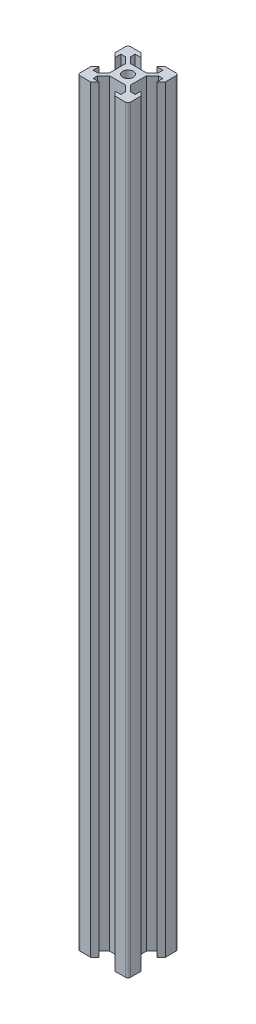
from build123d import *

# Parameters (mm, degrees)
MASTERLAYOUTSKETCH_R = 2.1
MAIN_EXTRUSION_DEPTH = 300
EDGE_FILLETS_R       = 1


with BuildPart() as part:
    # MasterLayoutSketch → Main Extrusion (new body)
    with BuildSketch(Plane(origin=(0, 0, 0), x_dir=(1, 0, 0), z_dir=(0, 1, 0))):
        Polygon((-8.325, 3.1), (-8.325, 5.5), (-6.560660172, 5.5), (-4.160660172, 3.1), (-4.160660172, -3.1), (-6.560660172, -5.5), (-8.325, -5.5), (-8.325, -3.1), (-10, -4.775), (-10, -10), (-4.775, -10), (-3.1, -8.325), (-5.5, -8.325), (-5.5, -6.560660172), (-3.1, -4.160660172), (3.1, -4.160660172), (5.5, -6.560660172), (5.5, -8.325), (3.1, -8.325), (4.775, -10), (10, -10), (10, -4.775), (8.325, -3.1), (8.325, -5.5), (6.560660172, -5.5), (4.160660172, -3.1), (4.160660172, 3.1), (6.560660172, 5.5), (8.325, 5.5), (8.325, 3.1), (10, 4.775), (10, 10), (4.775, 10), (3.1, 8.325), (5.5, 8.325), (5.5, 6.560660172), (3.1, 4.160660172), (-3.1, 4.160660172), (-5.5, 6.560660172), (-5.5, 8.325), (-3.1, 8.325), (-4.775, 10), (-10, 10), (-10, 4.775), align=None)
        with Locations(Location((0, 0, 0), (0, 0, 270))):
            Circle(MASTERLAYOUTSKETCH_R, mode=Mode.SUBTRACT)
    extrude(amount=MAIN_EXTRUSION_DEPTH)

    # Edge Fillets
    edge_fillets_edges = [part.edges().sort_by_distance(p)[0] for p in [
        (10, 150, -10),
        (10, 150, 10),
        (-10, 150, 10),
        (-10, 150, -10),
    ]]
    fillet(edge_fillets_edges, radius=EDGE_FILLETS_R)


solid = part.part
